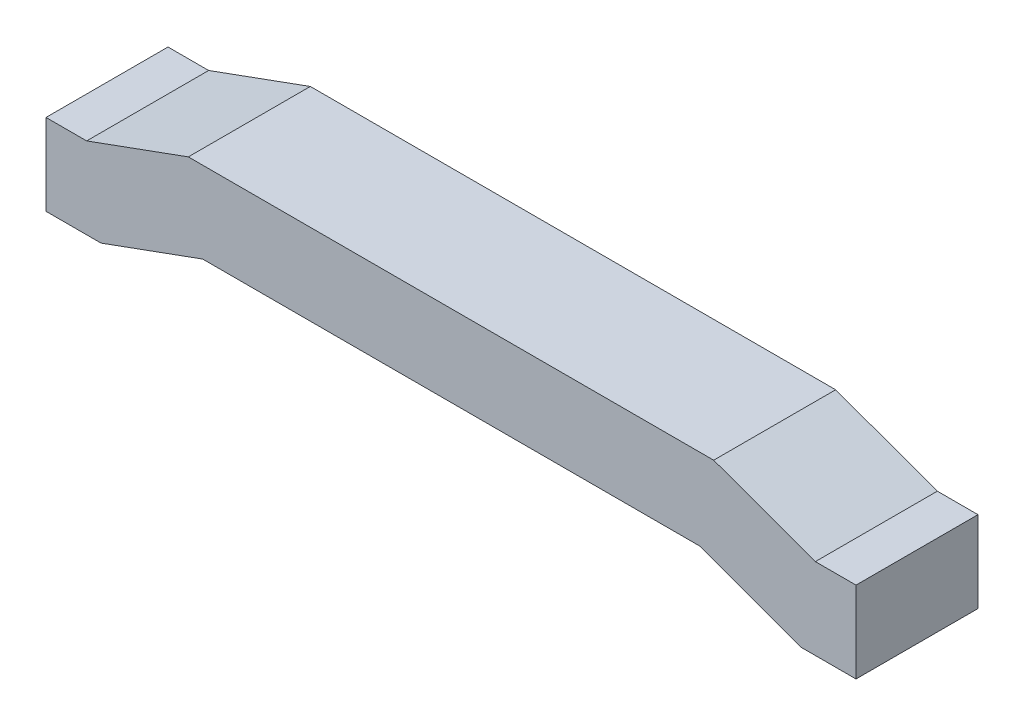
from build123d import *

# Parameters (mm, degrees)
BOSS_EXTRUDE1_DEPTH = 152.4


with BuildPart() as part:
    # Sketch1 → Boss-Extrude1 (new body)
    with BuildSketch(Plane.XY):
        Polygon((-508, 414.834481954), (-457.2, 414.834481954), (-330.2, 461.058701706), (184.406307369, 461.058701706), (326.08098336, 461.058701706), (453.08098336, 414.834481954), (503.88098336, 414.834481954), (503.88098336, 313.234481954), (435.16616212, 313.234481954), (308.16616212, 359.458701706), (184.406307369, 359.458701706), (-312.28517876, 359.458701706), (-439.28517876, 313.234481954), (-508, 313.234481954), align=None)
    extrude(amount=BOSS_EXTRUDE1_DEPTH)


solid = part.part
